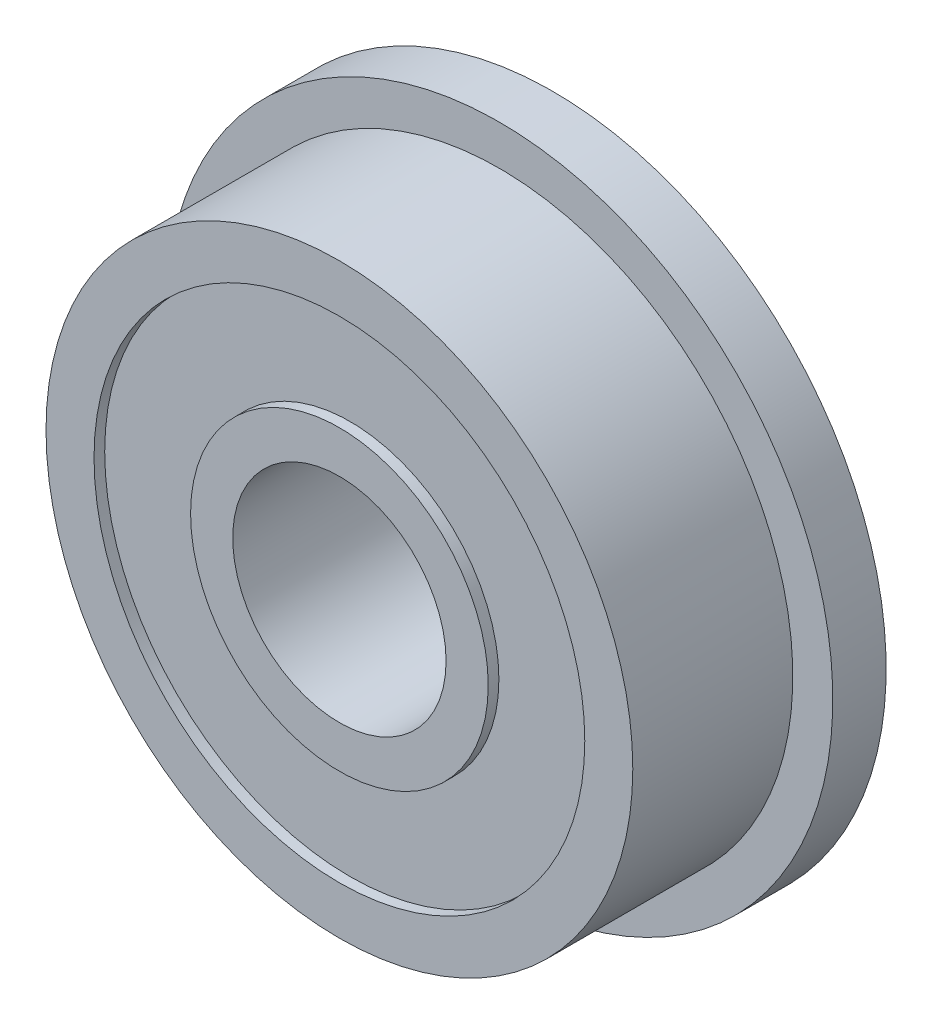
from build123d import *

# Parameters (mm, degrees)
SKETCH_1_R          = 5.5
EXTRUDE_1_DEPTH     = 2
SKETCH_4_R          = 6.25
EXTRUDE_2_DEPTH     = 1
SKETCH_2_R          = 2
CUT_EXTRUDE_1_DEPTH = 10.701803956
SKETCH_3_R          = 4.6
SKETCH_3_R_2        = 2.79
CUT_EXTRUDE_2_DEPTH = 0.2


with BuildPart() as part:
    # 草圖1 → 填料-伸長1 (new, symmetric)
    with BuildSketch(Plane.XY):
        Circle(SKETCH_1_R)
    extrude(amount=EXTRUDE_1_DEPTH, both=True)

    # 草圖4 → 填料-伸長2 (add)
    with BuildSketch(Plane(origin=(0, 0, -2), x_dir=(-1, 0, 0), z_dir=(0, 0, -1))):
        Circle(SKETCH_4_R)
    extrude(amount=-EXTRUDE_2_DEPTH)

    # 草圖2 → 除料-伸長1 (cut, through all)
    with BuildSketch(Plane.XY.offset(2)):
        Circle(SKETCH_2_R)
    extrude(amount=-CUT_EXTRUDE_1_DEPTH, mode=Mode.SUBTRACT)

    # 草圖3 → 除料-伸長2 (cut)
    with BuildSketch(Plane.XY.offset(2)):
        Circle(SKETCH_3_R)
        Circle(SKETCH_3_R_2, mode=Mode.SUBTRACT)
    cut_extrude_2 = extrude(amount=-CUT_EXTRUDE_2_DEPTH, mode=Mode.SUBTRACT)

    # 鏡射1: 除料-伸長2 across plane
    add(cut_extrude_2.mirror(Plane.XY), mode=Mode.SUBTRACT)


solid = part.part
